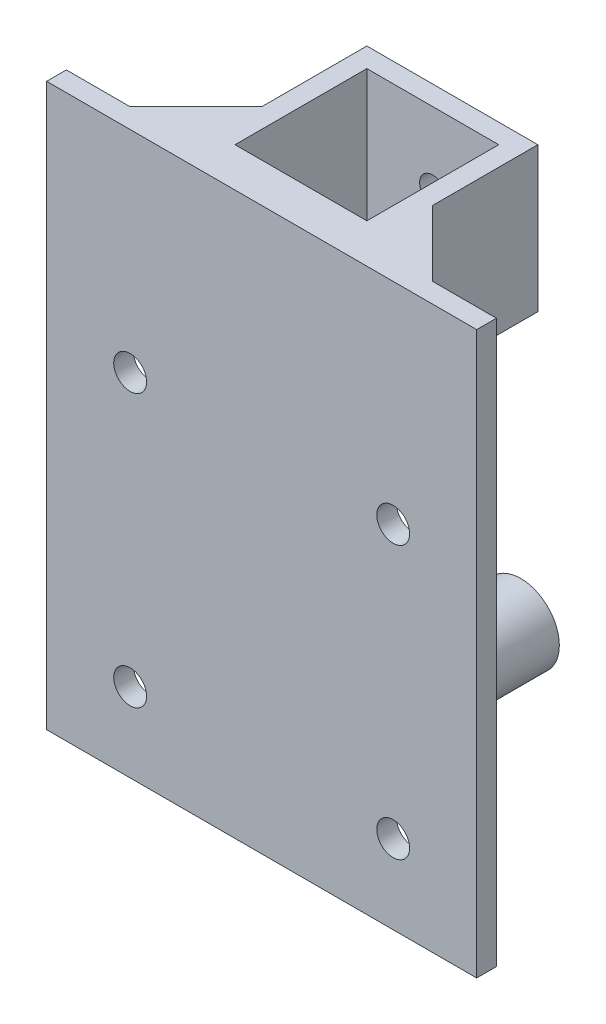
from build123d import *

# Parameters (mm, degrees)
SKETCH_1_W             = 65.4
SKETCH_1_H             = 85.4
SKETCH_1_R             = 2.5
EXTRUDE_632_DEPTH      = 3
SKETCH_2_W             = 26
SKETCH_2_H             = 22
EXTRUDE_871_DEPTH      = 26
SKETCH_3_W             = 20.05
SKETCH_3_H             = 20.05
CUT_EXTRUDE_1082_DEPTH = 95.724442463
SKETCH_8_R             = 5.872551453
EXTRUDE_1_DEPTH        = 14.4
SKETCH_4_R             = 2
EXTRUDE_3_DEPTH        = 14.4
SKETCH_12_R            = 5
EXTRUDE_5_DEPTH        = 21
SKETCH_13_R            = 2
CUT_EXTRUDE_1_DEPTH    = 6.6
SKETCH_14_R            = 2
CUT_EXTRUDE_3_DEPTH    = 8
CHAMFER_1_SIZE         = 10
CHAMFER_2_SIZE         = 10
SKETCH_15_R            = 2
CUT_EXTRUDE_4_DEPTH    = 8


with BuildPart() as part:
    # Эскиз1 → Extrude 632 (new body)
    with BuildSketch(Plane.XY):
        with Locations((-32.7, 42.7)):
            Rectangle(SKETCH_1_W, SKETCH_1_H)
        with Locations((-52.7, 53.4)):
            Circle(SKETCH_1_R, mode=Mode.SUBTRACT)
        with Locations(Location((-12.7, 53.4, 0), (0, 0, 180))):
            Circle(SKETCH_1_R, mode=Mode.SUBTRACT)
        with Locations((-12.7, 12)):
            Circle(SKETCH_1_R, mode=Mode.SUBTRACT)
        with Locations(Location((-52.7, 12, 0), (0, 0, 180))):
            Circle(SKETCH_1_R, mode=Mode.SUBTRACT)
    extrude(amount=EXTRUDE_632_DEPTH)

    # Эскиз2 → Extrude 871 (add)
    with BuildSketch(Plane(origin=(0, 0, 0), x_dir=(-1, 0, 0), z_dir=(0, 0, -1))):
        with Locations((32.7, 74.4)):
            Rectangle(SKETCH_2_W, SKETCH_2_H)
    extrude(amount=EXTRUDE_871_DEPTH)

    # Эскиз3 → Cut-Extrude 1082 (cut, through all)
    with BuildSketch(Plane.XZ.offset(-63.4)):
        with Locations((-32.7, -13)):
            Rectangle(SKETCH_3_W, SKETCH_3_H)
    extrude(amount=-CUT_EXTRUDE_1082_DEPTH, mode=Mode.SUBTRACT)

    # Эскиз8 → Бобышка-Вытянуть1 (add)
    with BuildSketch(Plane(origin=(0, 0, 0), x_dir=(-1, 0, 0), z_dir=(0, 0, -1))):
        with Locations(Location((10.7, 32.7, 0), (0, 0, 180))):
            Circle(SKETCH_8_R)
    extrude(amount=EXTRUDE_1_DEPTH)

    # Эскиз4 → Бобышка-Вытянуть3 (add)
    with BuildSketch(Plane(origin=(0, 0, 0), x_dir=(-1, 0, 0), z_dir=(0, 0, -1))):
        with Locations(Location((52.7, 32.7, 0), (0, 0, 180))):
            Circle(SKETCH_4_R)
    extrude(amount=EXTRUDE_3_DEPTH)

    # Эскиз12 → Бобышка-Вытянуть5 (add)
    with BuildSketch(Plane(origin=(0, 0, 0), x_dir=(-1, 0, 0), z_dir=(0, 0, -1))):
        with Locations(Location((54.7, 32.7, 0), (0, 0, 180))):
            Circle(SKETCH_12_R)
    extrude(amount=EXTRUDE_5_DEPTH)

    # Эскиз13 → Вырез-Вытянуть1 (cut)
    with BuildSketch(Plane(origin=(0, 0, -21), x_dir=(-1, 0, 0), z_dir=(0, 0, -1))):
        with Locations((54.7, 32.7)):
            Circle(SKETCH_13_R)
    extrude(amount=-CUT_EXTRUDE_1_DEPTH, mode=Mode.SUBTRACT)

    # Эскиз14 → Вырез-Вытянуть3 (cut)
    with BuildSketch(Plane(origin=(0, 0, -14.4), x_dir=(-1, 0, 0), z_dir=(0, 0, -1))):
        with Locations((10.7, 32.7)):
            Circle(SKETCH_14_R)
    extrude(amount=-CUT_EXTRUDE_3_DEPTH, mode=Mode.SUBTRACT)

    # Фаска1
    chamfer_1_edges = [part.edges().sort_by_distance(p)[0] for p in [
        (-45.7, 74.4, 0),
    ]]
    chamfer(chamfer_1_edges, length=CHAMFER_1_SIZE)

    # Фаска2
    chamfer_2_edges = [part.edges().sort_by_distance(p)[0] for p in [
        (-19.7, 74.4, 0),
    ]]
    chamfer(chamfer_2_edges, length=CHAMFER_2_SIZE)

    # Эскиз15 → Вырез-Вытянуть4 (cut)
    with BuildSketch(Plane(origin=(0, 0, -26), x_dir=(-1, 0, 0), z_dir=(0, 0, -1))):
        with Locations((32.7, 74.4)):
            Circle(SKETCH_15_R)
    extrude(amount=-CUT_EXTRUDE_4_DEPTH, mode=Mode.SUBTRACT)


solid = part.part
